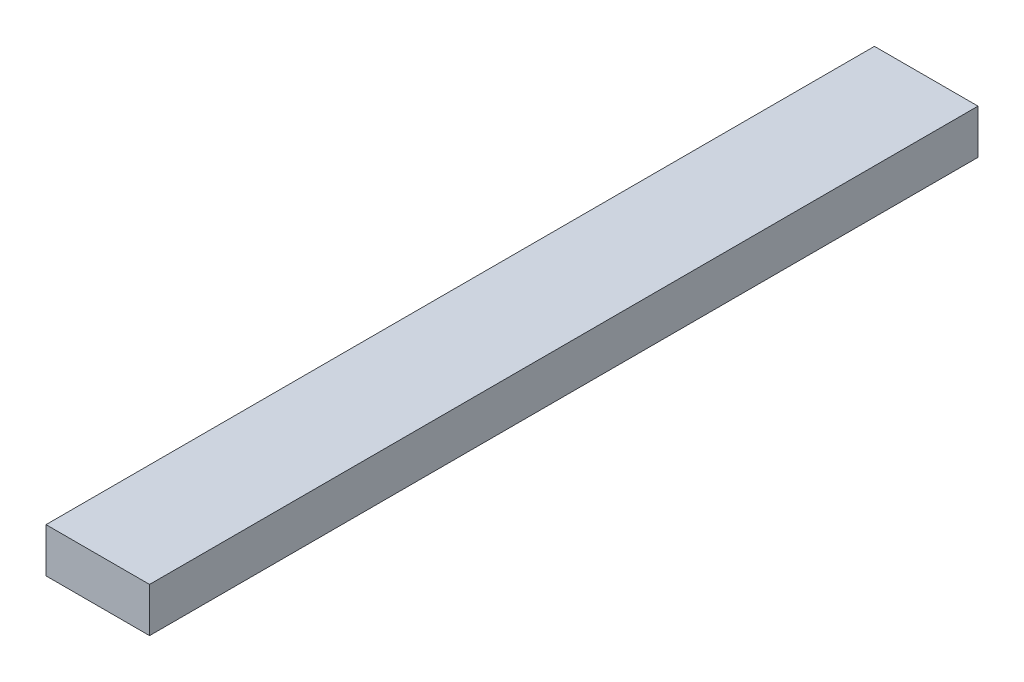
from build123d import *

# Parameters (mm, degrees)
SKETCH1_W           = 88.9
SKETCH1_H           = 38.1
BOSS_EXTRUDE1_DEPTH = 711.2


with BuildPart() as part:
    # Sketch1 → Boss-Extrude1 (new body)
    with BuildSketch(Plane.XY):
        with Locations((44.45, 19.05)):
            Rectangle(SKETCH1_W, SKETCH1_H)
    extrude(amount=BOSS_EXTRUDE1_DEPTH)


solid = part.part
